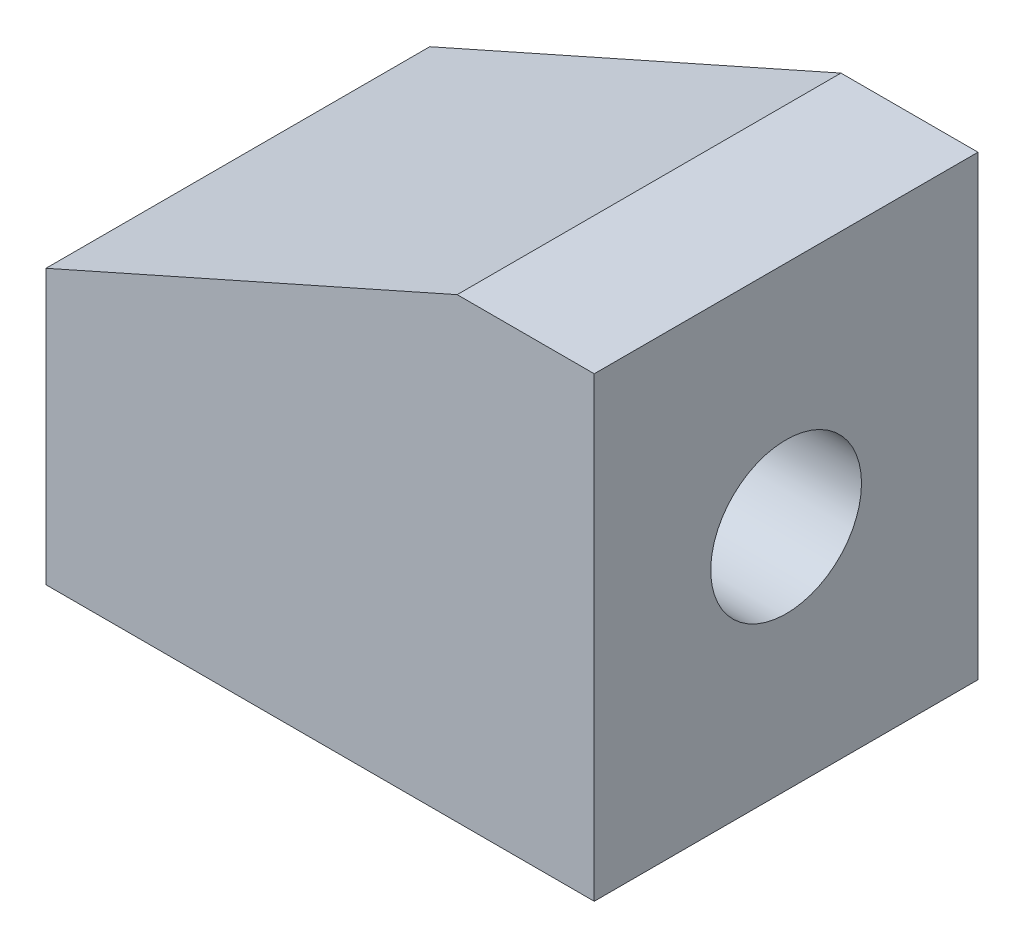
from build123d import *

# Parameters (mm, degrees)
BOSS_EXTRUDE1_DEPTH        = 42
M18X1_5_TAPPED_HOLE1_D     = 16.5
M18X1_5_TAPPED_HOLE1_DEPTH = 43.5
M18X1_5_TAPPED_HOLE1_TIP   = 4.957100107


with BuildPart() as part:
    # Sketch1 → Boss-Extrude1 (new body)
    with BuildSketch(Plane.XY):
        Polygon((0, 0), (0, -30), (60, -30), (60, 20), (45, 20), align=None)
    extrude(amount=BOSS_EXTRUDE1_DEPTH)

    # M18x1.5 Tapped Hole1
    with Locations(Plane(origin=(60, -5, 21), x_dir=(0, 0, 1), z_dir=(1, 0, 0))):
        with Locations((0, 0)):
            Hole(M18X1_5_TAPPED_HOLE1_D / 2, depth=M18X1_5_TAPPED_HOLE1_DEPTH)
            with Locations((0, 0, -(M18X1_5_TAPPED_HOLE1_DEPTH + M18X1_5_TAPPED_HOLE1_TIP / 2))):  # 118° drill point
                Cone(0, M18X1_5_TAPPED_HOLE1_D / 2, M18X1_5_TAPPED_HOLE1_TIP, mode=Mode.SUBTRACT)


solid = part.part
